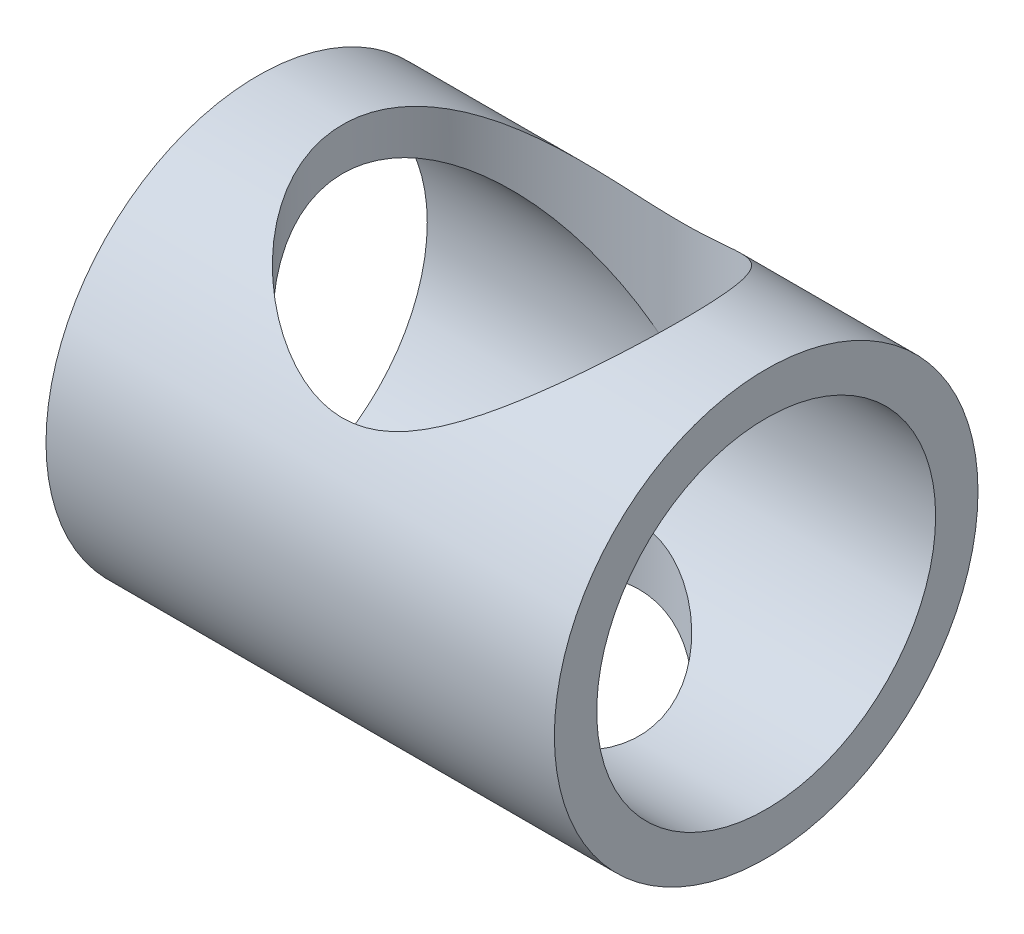
from build123d import *

# Parameters (mm, degrees)
SKETCH_1_R          = 25
EXTRUDE_1_DEPTH     = 30
SKETCH_2_R          = 20
CUT_EXTRUDE_1_DEPTH = 30
SKETCH_3_R          = 20
CUT_EXTRUDE_2_DEPTH = 40
SKETCH_4_R          = 15
CUT_EXTRUDE_4_DEPTH = 200


with BuildPart() as part:
    # 草图1 → 凸台-拉伸1 (new, symmetric)
    with BuildSketch(Plane(origin=(0, 0, 0), x_dir=(0, 0, -1), z_dir=(1, 0, 0))):
        Circle(SKETCH_1_R)
    extrude(amount=EXTRUDE_1_DEPTH, both=True)

    # 草图2 → 切除-拉伸1 (cut, symmetric)
    with BuildSketch(Plane(origin=(0, 0, 0), x_dir=(0, 0, -1), z_dir=(1, 0, 0))):
        Circle(SKETCH_2_R)
    extrude(amount=CUT_EXTRUDE_1_DEPTH, both=True, mode=Mode.SUBTRACT)

    # 草图3 → 切除-拉伸2 (cut)
    with BuildSketch(Plane(origin=(0, 0, 0), x_dir=(1, 0, 0), z_dir=(0, 1, 0))):
        with Locations(Location((0, 0, 0), (0, 0, 90))):
            Circle(SKETCH_3_R)
    extrude(amount=CUT_EXTRUDE_2_DEPTH, mode=Mode.SUBTRACT)

    # 草图4 → 切除-拉伸4 (cut)
    with BuildSketch(Plane(origin=(0, 0, 0), x_dir=(1, 0, 0), z_dir=(0, 1, 0))):
        with Locations(Location((0, 0, 0), (0, 0, 270))):
            Circle(SKETCH_4_R)
    extrude(amount=-CUT_EXTRUDE_4_DEPTH, mode=Mode.SUBTRACT)


solid = part.part
